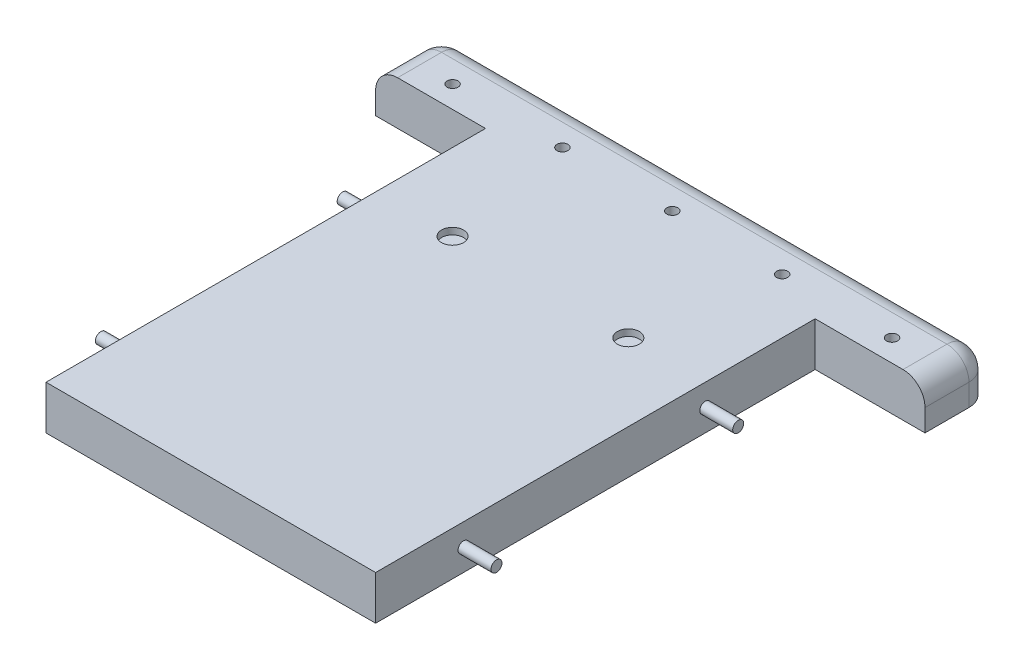
from build123d import *

# Parameters (mm, degrees)
BOSS_EXTRUDE1_DEPTH      = 20
SKETCH4_R                = 2.5
CUT_EXTRUDE2_DEPTH       = 5
FILLET1_R                = 10
FILLET2_R                = 10
SKETCH6_R                = 2.5
CUT_EXTRUDE3_DEPTH       = 5
SKETCH8_R                = 5
CUT_EXTRUDE5_DEPTH       = 3
BOSS_EXTRUDE2_DEPTH      = 15
BOSS_EXTRUDE2_DEPTH_BACK = 165
SKETCH2_R                = 2.5


with BuildPart() as part:
    # Sketch1 → Boss-Extrude1 (new body)
    with BuildSketch(Plane(origin=(0, 0, 0), x_dir=(1, 0, 0), z_dir=(0, 1, 0))):
        Polygon((-75, -100), (75, -100), (75, 100), (125, 100), (125, 130), (-125, 130), (-125, 100), (-75, 100), align=None)
    extrude(amount=BOSS_EXTRUDE1_DEPTH)

    # Sketch4 → Cut-Extrude2 (cut)
    with BuildSketch(Plane.XZ):
        with Locations(Location((-100, -115, 0), (0, 0, 270))):
            Circle(SKETCH4_R)
        with Locations(Location((-50, -115, 0), (0, 0, 270))):
            Circle(SKETCH4_R)
        with Locations(Location((0, -115, 0), (0, 0, 270))):
            Circle(SKETCH4_R)
        with Locations(Location((50, -115, 0), (0, 0, 90))):
            Circle(SKETCH4_R)
        with Locations(Location((100, -115, 0), (0, 0, 90))):
            Circle(SKETCH4_R)
    extrude(amount=-CUT_EXTRUDE2_DEPTH, mode=Mode.SUBTRACT)

    # Fillet1
    fillet1_edges = [part.edges().sort_by_distance(p)[0] for p in [
        (-125, 10, -130),
        (125, 10, -130),
    ]]
    fillet(fillet1_edges, radius=FILLET1_R)

    # Fillet2
    fillet2_edges = [part.edges().sort_by_distance(p)[0] for p in [
        (125, 20, -110),
        (0, 20, -130),
        (-125, 20, -110),
        (-122.071067812, 20, -127.071067812),
        (122.071067812, 20, -127.071067812),
    ]]
    fillet(fillet2_edges, radius=FILLET2_R)

    # Sketch6 → Cut-Extrude3 (cut)
    with BuildSketch(Plane(origin=(0, 20, 0), x_dir=(1, 0, 0), z_dir=(0, 1, 0))):
        with Locations(Location((0, 110, 0), (0, 0, 270))):
            Circle(SKETCH6_R)
        with Locations(Location((50, 110, 0), (0, 0, 270))):
            Circle(SKETCH6_R)
        with Locations(Location((100, 110, 0), (0, 0, 270))):
            Circle(SKETCH6_R)
        with Locations(Location((-50, 110, 0), (0, 0, 90))):
            Circle(SKETCH6_R)
        with Locations(Location((-100, 110, 0), (0, 0, 90))):
            Circle(SKETCH6_R)
    extrude(amount=-CUT_EXTRUDE3_DEPTH, mode=Mode.SUBTRACT)

    # Sketch8 → Cut-Extrude5 (cut)
    with BuildSketch(Plane(origin=(0, 20, 0), x_dir=(1, 0, 0), z_dir=(0, 1, 0))):
        with Locations(Location((-40, 50, 0), (0, 0, 270))):
            Circle(SKETCH8_R)
        with Locations(Location((40, 50, 0), (0, 0, 90))):
            Circle(SKETCH8_R)
    extrude(amount=-CUT_EXTRUDE5_DEPTH, mode=Mode.SUBTRACT)

    # Sketch2 → Boss-Extrude2 (add, two sides: drawn at the far end of the back side and taken through both)
    with BuildSketch(Plane.ZY.offset(75).offset(-BOSS_EXTRUDE2_DEPTH_BACK)):
        with Locations((60, 10)):
            Circle(SKETCH2_R)
        with Locations((-50, 10)):
            Circle(SKETCH2_R)
    extrude(amount=BOSS_EXTRUDE2_DEPTH + BOSS_EXTRUDE2_DEPTH_BACK)


solid = part.part
